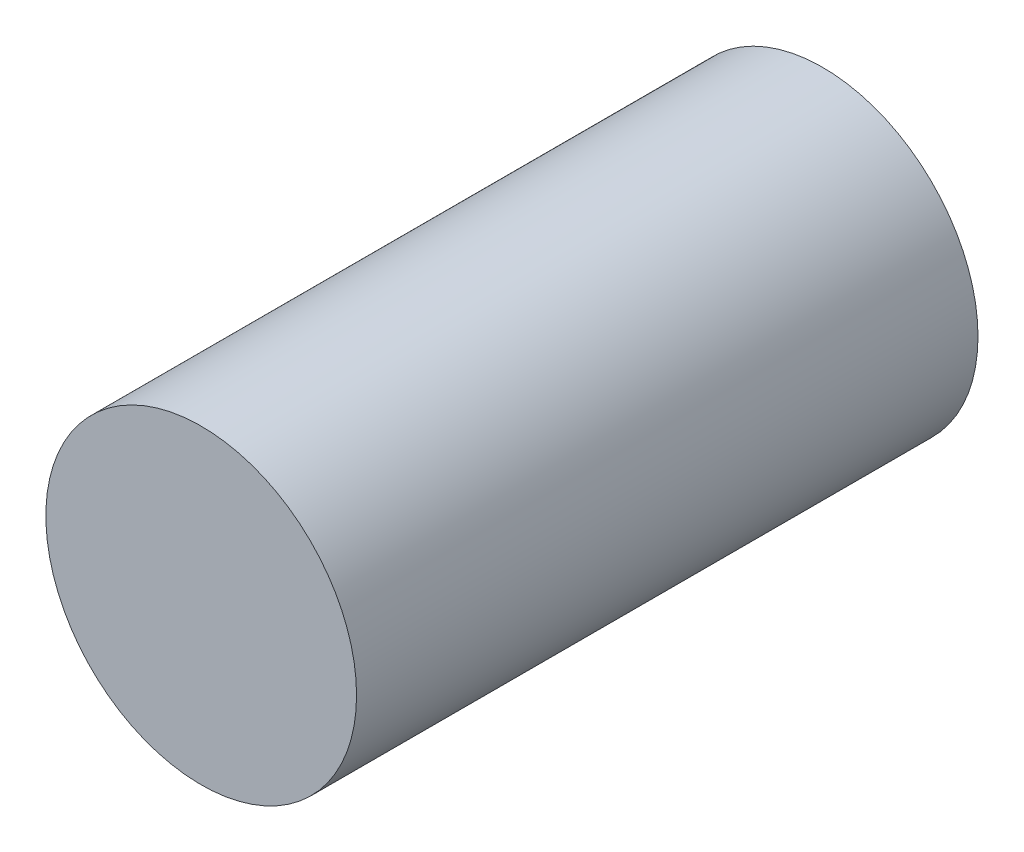
from build123d import *

# Parameters (mm, degrees)
SKETCH1_R           = 12.7
BOSS_EXTRUDE1_DEPTH = 50.8


with BuildPart() as part:
    # Sketch1 → Boss-Extrude1 (new body)
    with BuildSketch(Plane.XY):
        Circle(SKETCH1_R)
    extrude(amount=BOSS_EXTRUDE1_DEPTH)


solid = part.part
